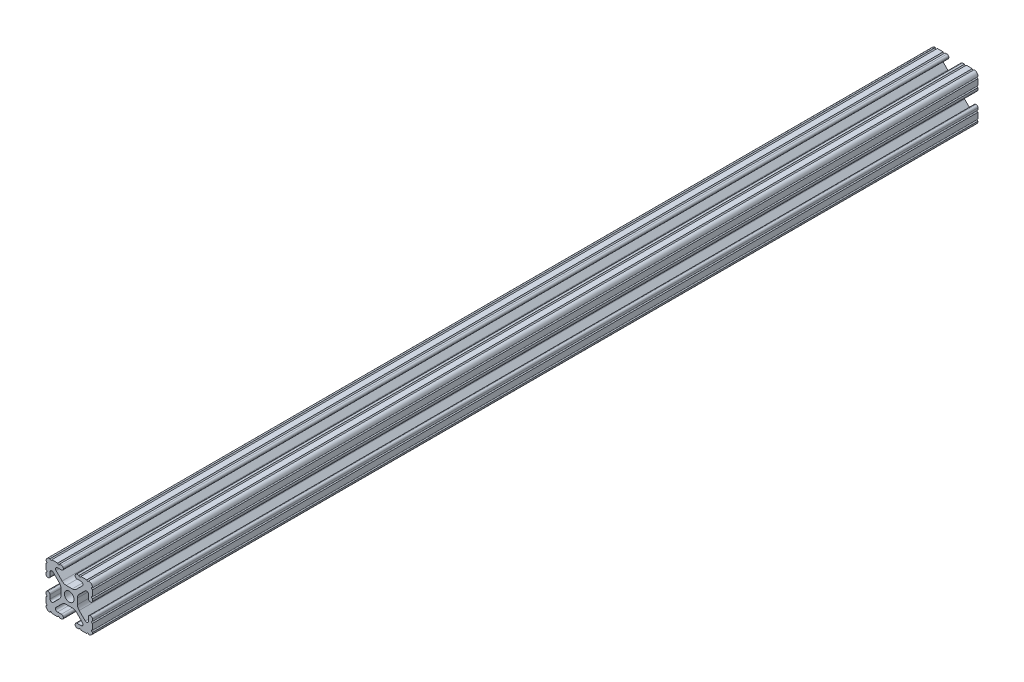
from build123d import *

# Parameters (mm, degrees)
SKETCH1_R           = 2.6035
BOSS_EXTRUDE1_DEPTH = 304.8
SKETCH2_W           = 30.080863632
SKETCH2_H           = 32.411853065
CUT_EXTRUDE1_DEPTH  = 125.73


with BuildPart() as part:
    # Sketch1 → Boss-Extrude1 (new, symmetric)
    with BuildSketch(Plane.XY):
        with BuildLine():
            Line((-7.179650497, -8.645192506), (-3.952270251, -5.423690499))
            ThreePointArc((-3.952270251, -5.423690499), (-2.922936451, -4.736929036), (-1.709253557, -4.4958))
            Line((-1.709253557, -4.4958), (1.709253557, -4.4958))
            ThreePointArc((1.709253557, -4.4958), (2.922936451, -4.736929036), (3.952270251, -5.423690499))
            Line((3.952270251, -5.423690499), (7.179650497, -8.645192506))
            ThreePointArc((7.179650497, -8.645192506), (7.41473083, -9.822813117), (6.416408329, -10.4902))
            Line((6.416408329, -10.4902), (4.287512407, -10.4902))
            ThreePointArc((4.287512407, -10.4902), (3.54574862, -10.79744862), (3.2385, -11.539212407))
            Line((3.2385, -11.539212407), (3.2385, -11.650987593))
            ThreePointArc((3.2385, -11.650987593), (3.54574862, -12.39275138), (4.287512407, -12.7))
            Line((4.287512407, -12.7), (5.317126718, -12.7))
            ThreePointArc((5.317126718, -12.7), (5.825126718, -12.192), (6.333126718, -12.7))
            Line((6.333126718, -12.7), (9.550443118, -12.7))
            ThreePointArc((9.550443118, -12.7), (10.058366869, -12.192000006), (10.566443095, -12.699847501))
            ThreePointArc((10.566443095, -12.699847501), (12.082537762, -12.08250727), (12.699846982, -10.566399977))
            ThreePointArc((12.699846982, -10.566399977), (12.192000006, -10.058323491), (12.7, -9.5504))
            Line((12.7, -9.5504), (12.7, -6.3330836))
            ThreePointArc((12.7, -6.3330836), (12.192, -5.8250836), (12.7, -5.3170836))
            Line((12.7, -5.3170836), (12.7, -4.287469289))
            ThreePointArc((12.7, -4.287469289), (12.39275138, -3.545705502), (11.650987593, -3.238456882))
            Line((11.650987593, -3.238456882), (11.539212407, -3.238456882))
            ThreePointArc((11.539212407, -3.238456882), (10.79744862, -3.545705502), (10.4902, -4.287469289))
            Line((10.4902, -4.287469289), (10.4902, -6.402089023))
            ThreePointArc((10.4902, -6.402089023), (9.856505071, -7.351067942), (8.737131347, -7.129408934))
            Line((8.737131347, -7.129408934), (5.441005833, -3.840816462))
            ThreePointArc((5.441005833, -3.840816462), (4.750877967, -2.809883091), (4.5085, -1.593185507))
            Line((4.5085, -1.593185507), (4.5085, 1.593185507))
            ThreePointArc((4.5085, 1.593185507), (4.750877967, 2.809883091), (5.441005833, 3.840816462))
            Line((5.441005833, 3.840816462), (8.737131347, 7.129408934))
            ThreePointArc((8.737131347, 7.129408934), (9.856505071, 7.351067942), (10.4902, 6.402089023))
            Line((10.4902, 6.402089023), (10.4902, 4.287469289))
            ThreePointArc((10.4902, 4.287469289), (10.79744862, 3.545705502), (11.539212407, 3.238456882))
            Line((11.539212407, 3.238456882), (11.650987593, 3.238456882))
            ThreePointArc((11.650987593, 3.238456882), (12.39275138, 3.545705502), (12.7, 4.287469289))
            Line((12.7, 4.287469289), (12.7, 5.3170836))
            ThreePointArc((12.7, 5.3170836), (12.192, 5.8250836), (12.7, 6.3330836))
            Line((12.7, 6.3330836), (12.7, 9.5504))
            ThreePointArc((12.7, 9.5504), (12.192000006, 10.058323491), (12.699846982, 10.566399977))
            ThreePointArc((12.699846982, 10.566399977), (12.082537762, 12.08250727), (10.566443095, 12.699847501))
            ThreePointArc((10.566443095, 12.699847501), (10.058366869, 12.192000006), (9.550443118, 12.7))
            Line((9.550443118, 12.7), (6.333126718, 12.7))
            ThreePointArc((6.333126718, 12.7), (5.825126718, 12.192), (5.317126718, 12.7))
            Line((5.317126718, 12.7), (4.287512407, 12.7))
            ThreePointArc((4.287512407, 12.7), (3.54574862, 12.39275138), (3.2385, 11.650987593))
            Line((3.2385, 11.650987593), (3.2385, 11.539212407))
            ThreePointArc((3.2385, 11.539212407), (3.54574862, 10.79744862), (4.287512407, 10.4902))
            Line((4.287512407, 10.4902), (6.476788598, 10.4902))
            ThreePointArc((6.476788598, 10.4902), (7.432222385, 9.85140422), (7.207036008, 8.724370562))
            Line((7.207036008, 8.724370562), (3.898272566, 5.423169045))
            ThreePointArc((3.898272566, 5.423169045), (2.869120213, 4.736787962), (1.655778399, 4.4958))
            Line((1.655778399, 4.4958), (-1.655778399, 4.4958))
            ThreePointArc((-1.655778399, 4.4958), (-2.869120213, 4.736787962), (-3.898272566, 5.423169045))
            Line((-3.898272566, 5.423169045), (-7.207036008, 8.724370562))
            ThreePointArc((-7.207036008, 8.724370562), (-7.432222385, 9.85140422), (-6.476788598, 10.4902))
            Line((-6.476788598, 10.4902), (-4.287512407, 10.4902))
            ThreePointArc((-4.287512407, 10.4902), (-3.54574862, 10.79744862), (-3.2385, 11.539212407))
            Line((-3.2385, 11.539212407), (-3.2385, 11.650987593))
            ThreePointArc((-3.2385, 11.650987593), (-3.54574862, 12.39275138), (-4.287512407, 12.7))
            Line((-4.287512407, 12.7), (-5.317126718, 12.7))
            ThreePointArc((-5.317126718, 12.7), (-5.825126718, 12.192), (-6.333126718, 12.7))
            Line((-6.333126718, 12.7), (-9.550443118, 12.7))
            ThreePointArc((-9.550443118, 12.7), (-10.058366869, 12.192000006), (-10.566443095, 12.699847501))
            ThreePointArc((-10.566443095, 12.699847501), (-12.082537762, 12.08250727), (-12.699846982, 10.566399977))
            ThreePointArc((-12.699846982, 10.566399977), (-12.192000006, 10.058323491), (-12.7, 9.5504))
            Line((-12.7, 9.5504), (-12.7, 6.3330836))
            ThreePointArc((-12.7, 6.3330836), (-12.192, 5.8250836), (-12.7, 5.3170836))
            Line((-12.7, 5.3170836), (-12.7, 4.287469289))
            ThreePointArc((-12.7, 4.287469289), (-12.39275138, 3.545705502), (-11.650987593, 3.238456882))
            Line((-11.650987593, 3.238456882), (-11.539212407, 3.238456882))
            ThreePointArc((-11.539212407, 3.238456882), (-10.79744862, 3.545705502), (-10.4902, 4.287469289))
            Line((-10.4902, 4.287469289), (-10.4902, 6.402089023))
            ThreePointArc((-10.4902, 6.402089023), (-9.856505071, 7.351067942), (-8.737131347, 7.129408934))
            Line((-8.737131347, 7.129408934), (-5.441005833, 3.840816462))
            ThreePointArc((-5.441005833, 3.840816462), (-4.750877967, 2.809883091), (-4.5085, 1.593185507))
            Line((-4.5085, 1.593185507), (-4.5085, -1.593185507))
            ThreePointArc((-4.5085, -1.593185507), (-4.750877967, -2.809883091), (-5.441005833, -3.840816462))
            Line((-5.441005833, -3.840816462), (-8.737131347, -7.129408934))
            ThreePointArc((-8.737131347, -7.129408934), (-9.856505071, -7.351067942), (-10.4902, -6.402089023))
            Line((-10.4902, -6.402089023), (-10.4902, -4.287469289))
            ThreePointArc((-10.4902, -4.287469289), (-10.79744862, -3.545705502), (-11.539212407, -3.238456882))
            Line((-11.539212407, -3.238456882), (-11.650987593, -3.238456882))
            ThreePointArc((-11.650987593, -3.238456882), (-12.39275138, -3.545705502), (-12.7, -4.287469289))
            Line((-12.7, -4.287469289), (-12.7, -5.3170836))
            ThreePointArc((-12.7, -5.3170836), (-12.192, -5.8250836), (-12.7, -6.3330836))
            Line((-12.7, -6.3330836), (-12.7, -9.5504))
            ThreePointArc((-12.7, -9.5504), (-12.192000006, -10.058323491), (-12.699846982, -10.566399977))
            ThreePointArc((-12.699846982, -10.566399977), (-12.082537762, -12.08250727), (-10.566443095, -12.699847501))
            ThreePointArc((-10.566443095, -12.699847501), (-10.058366869, -12.192000006), (-9.550443118, -12.7))
            Line((-9.550443118, -12.7), (-6.333126718, -12.7))
            ThreePointArc((-6.333126718, -12.7), (-5.825126718, -12.192), (-5.317126718, -12.7))
            Line((-5.317126718, -12.7), (-4.287512407, -12.7))
            ThreePointArc((-4.287512407, -12.7), (-3.54574862, -12.39275138), (-3.2385, -11.650987593))
            Line((-3.2385, -11.650987593), (-3.2385, -11.539212407))
            ThreePointArc((-3.2385, -11.539212407), (-3.54574862, -10.79744862), (-4.287512407, -10.4902))
            Line((-4.287512407, -10.4902), (-6.416408329, -10.4902))
            ThreePointArc((-6.416408329, -10.4902), (-7.41473083, -9.822813117), (-7.179650497, -8.645192506))
        make_face()
        with Locations(Location((0, 0, 0), (0, 0, 180))):
            Circle(SKETCH1_R, mode=Mode.SUBTRACT)
    extrude(amount=BOSS_EXTRUDE1_DEPTH, both=True)

    # Sketch2 → Cut-Extrude1 (cut)
    with BuildSketch(Plane.XY.offset(304.8)):
        with Locations((-0.166499245, 0.33299849)):
            Rectangle(SKETCH2_W, SKETCH2_H)
    extrude(amount=-CUT_EXTRUDE1_DEPTH, mode=Mode.SUBTRACT)


solid = part.part
